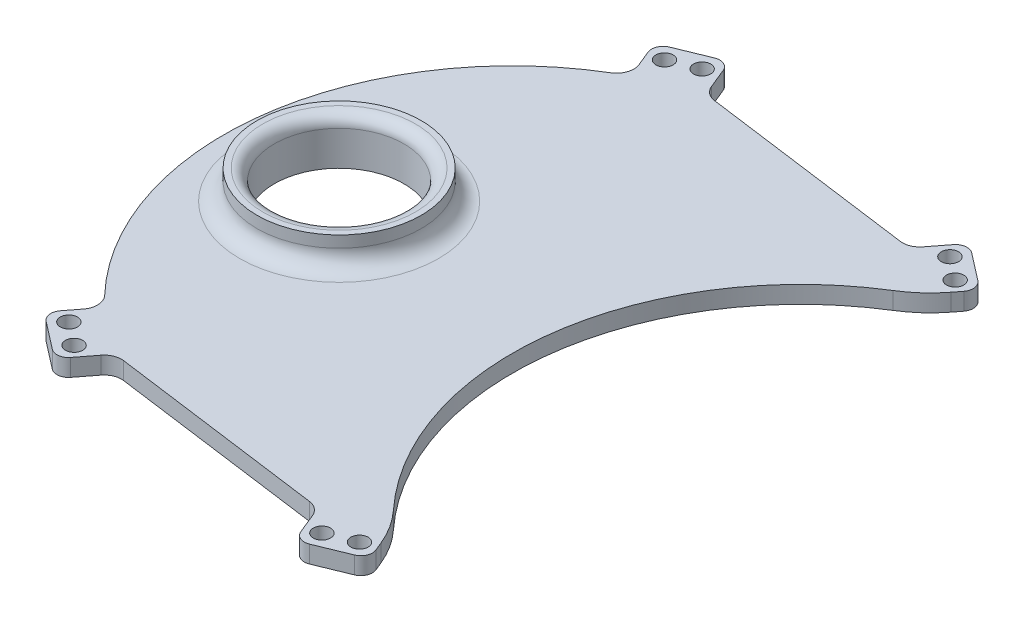
from build123d import *

# Parameters (mm, degrees)
BOSS_EXTRUDE1_DEPTH   = 3
BOSS_EXTRUDE1_2_DEPTH = 3
BOSS_EXTRUDE1_3_DEPTH = 3
BOSS_EXTRUDE1_4_DEPTH = 3
BOSS_EXTRUDE2_START   = -3
SKETCH2_R             = 11.25
BOSS_EXTRUDE2_DEPTH   = 3
CUT_EXTRUDE1_REACH    = 76.288
SKETCH3_R             = 1.5
FILLET1_R             = 2
SKETCH4_R             = 14.25
SKETCH4_R_2           = 11.25
BOSS_EXTRUDE3_DEPTH   = 5
FILLET3_R             = 2
FILLET2_R             = 3
CUT_EXTRUDE2_REACH    = 76.396
SKETCH6_R             = 1.5
FILLET4_R             = 2
CUT_EXTRUDE3_REACH    = 76.396
SKETCH7_R             = 1.5
FILLET5_R             = 2
CUT_EXTRUDE4_REACH    = 75.948
SKETCH8_R             = 1.5
FILLET6_R             = 2
FILLET7_R             = 3
FILLET8_R             = 20


with BuildPart() as part:
    # Sketch1 → Boss-Extrude1 (new body)
    with BuildSketch(Plane(origin=(0, 0, 0), x_dir=(1, 0, 0), z_dir=(0, 1, 0))):
        with BuildLine():
            Line((-34.371558273, -36.312476945), (-38.95676142, -42.247619075))
            Line((-38.95676142, -42.247619075), (-31.04323858, -48.361223271))
            Line((-31.04323858, -48.361223271), (-26.458035433, -42.426081141))
            ThreePointArc((-26.458035433, -42.426081141), (-30.568020981, -39.567614198), (-34.371558273, -36.312476945))
        make_face()
    extrude(amount=BOSS_EXTRUDE1_DEPTH)



with BuildPart() as body_2:
    # Sketch1 → Boss-Extrude1 2 (new body)
    with BuildSketch(Plane(origin=(0, 0, 0), x_dir=(1, 0, 0), z_dir=(0, 1, 0))):
        with BuildLine():
            Line((14.261748373, -47.922881104), (17.109130658, -54.861354576))
            Line((17.109130658, -54.861354576), (26.360428621, -51.064844862))
            Line((26.360428621, -51.064844862), (23.513046335, -44.12637139))
            ThreePointArc((23.513046335, -44.12637139), (18.982548572, -46.256489812), (14.261748373, -47.922881104))
        make_face()
    extrude(amount=BOSS_EXTRUDE1_2_DEPTH)


with BuildPart() as body_3:
    # Sketch1 → Boss-Extrude1 3 (new body)
    with BuildSketch(Plane(origin=(0, 0, 0), x_dir=(1, 0, 0), z_dir=(0, 1, 0))):
        with BuildLine():
            Line((34.371558273, 36.312476945), (38.95676142, 42.247619075))
            Line((38.95676142, 42.247619075), (31.04323858, 48.361223271))
            Line((31.04323858, 48.361223271), (26.458035433, 42.426081141))
            ThreePointArc((26.458035433, 42.426081141), (30.568020981, 39.567614198), (34.371558273, 36.312476945))
        make_face()
    extrude(amount=BOSS_EXTRUDE1_3_DEPTH)


with BuildPart() as body_4:
    # Sketch1 → Boss-Extrude1 4 (new body)
    with BuildSketch(Plane(origin=(0, 0, 0), x_dir=(1, 0, 0), z_dir=(0, 1, 0))):
        with BuildLine():
            Line((-14.261748373, 47.922881104), (-17.109130658, 54.861354576))
            Line((-17.109130658, 54.861354576), (-26.360428621, 51.064844862))
            Line((-26.360428621, 51.064844862), (-23.513046335, 44.12637139))
            ThreePointArc((-23.513046335, 44.12637139), (-18.982548572, 46.256489812), (-14.261748373, 47.922881104))
        make_face()
    extrude(amount=BOSS_EXTRUDE1_4_DEPTH)


with BuildPart() as part_1:
    add(part.part)

    add(body_2.part)  # Boss-Extrude2 merges body 2

    add(body_3.part)  # Boss-Extrude2 merges body 3

    add(body_4.part)  # Boss-Extrude2 merges body 4
    # Sketch2 → Boss-Extrude2 (add)
    with BuildSketch(Plane(origin=(0, 3, 0), x_dir=(1, 0, 0), z_dir=(0, 1, 0)).offset(BOSS_EXTRUDE2_START)):
        with BuildLine():
            Line((-26.458035433, -42.426081141), (14.261748373, -47.922881104))
            ThreePointArc((14.261748373, -47.922881104), (18.982548572, -46.256489812), (23.513046335, -44.12637139))
            ThreePointArc((23.513046335, -44.12637139), (8.334035055, -1.125018831), (34.371558273, 36.312476945))
            ThreePointArc((34.371558273, 36.312476945), (30.568020981, 39.567614198), (26.458035433, 42.426081141))
            Line((26.458035433, 42.426081141), (-14.261748373, 47.922881104))
            ThreePointArc((-14.261748373, 47.922881104), (-18.982548572, 46.256489812), (-23.513046335, 44.12637139))
            ThreePointArc((-23.513046335, 44.12637139), (-49.550569553, 6.688875614), (-34.371558273, -36.312476945))
            ThreePointArc((-34.371558273, -36.312476945), (-30.568020981, -39.567614198), (-26.458035433, -42.426081141))
        make_face()
        with Locations(Location((-30, 0, 0), (0, 0, 270))):
            Circle(SKETCH2_R, mode=Mode.SUBTRACT)
    extrude(amount=BOSS_EXTRUDE2_DEPTH)

    # Sketch3 → Cut-Extrude1 (cut, up to next)
    with BuildSketch(Plane(origin=(0, 3, 0), x_dir=(1, 0, 0), z_dir=(0, 1, 0)), mode=Mode.PRIVATE) as cut_extrude1_sk1:
        with Locations(Location((-35.297139556, -41.599801343, 0), (0, 0, 270))):
            Circle(SKETCH3_R)
    cut_extrude1_tool1 = extrude(cut_extrude1_sk1.sketch, amount=-CUT_EXTRUDE1_REACH, mode=Mode.PRIVATE) & part_1.part
    # Sketch3 → Cut-Extrude1 (cut, up to next)
    with BuildSketch(Plane(origin=(0, 3, 0), x_dir=(1, 0, 0), z_dir=(0, 1, 0)), mode=Mode.PRIVATE) as cut_extrude1_sk2:
        with Locations(Location((-31.340378136, -44.656603441, 0), (0, 0, 270))):
            Circle(SKETCH3_R)
    cut_extrude1_tool2 = extrude(cut_extrude1_sk2.sketch, amount=-CUT_EXTRUDE1_REACH, mode=Mode.PRIVATE) & part_1.part
    add(cut_extrude1_tool1.solids().sort_by_distance((-35.29714, 3, 41.599801))[0], mode=Mode.SUBTRACT)
    add(cut_extrude1_tool2.solids().sort_by_distance((-31.340378, 3, 44.656603))[0], mode=Mode.SUBTRACT)

    # Fillet1
    fillet1_edges = [part_1.edges().sort_by_distance(p)[0] for p in [
        (-31.04323858, 1.5, 48.361223271),
        (-38.95676142, 1.5, 42.247619075),
    ]]
    fillet(fillet1_edges, radius=FILLET1_R)

    # Sketch4 → Boss-Extrude3 (add)
    with BuildSketch(Plane(origin=(0, 3, 0), x_dir=(1, 0, 0), z_dir=(0, 1, 0))):
        with Locations(Location((-30, 0, 0), (0, 0, 270))):
            Circle(SKETCH4_R)
        with Locations(Location((-30, 0, 0), (0, 0, 270))):
            Circle(SKETCH4_R_2, mode=Mode.SUBTRACT)
    extrude(amount=BOSS_EXTRUDE3_DEPTH)

    # Fillet3
    fillet3_edges = [part_1.edges().sort_by_distance(p)[0] for p in [
        (-30, 8, -11.25),
    ]]
    fillet(fillet3_edges, radius=FILLET3_R)

    # Fillet2
    fillet2_edges = [part_1.edges().sort_by_distance(p)[0] for p in [
        (-30, 3, -14.25),
    ]]
    fillet(fillet2_edges, radius=FILLET2_R)

    # Sketch6 → Cut-Extrude2 (cut, up to next)
    with BuildSketch(Plane(origin=(0, 3, 0), x_dir=(1, 0, 0), z_dir=(0, 1, 0)), mode=Mode.PRIVATE) as cut_extrude2_sk1:
        with Locations(Location((18.377914978, -51.368120208, 0), (0, 0, 270))):
            Circle(SKETCH6_R)
    cut_extrude2_tool1 = extrude(cut_extrude2_sk1.sketch, amount=-CUT_EXTRUDE2_REACH, mode=Mode.PRIVATE) & part_1.part
    # Sketch6 → Cut-Extrude2 (cut, up to next)
    with BuildSketch(Plane(origin=(0, 3, 0), x_dir=(1, 0, 0), z_dir=(0, 1, 0)), mode=Mode.PRIVATE) as cut_extrude2_sk2:
        with Locations(Location((23.003563959, -49.469865351, 0), (0, 0, 270))):
            Circle(SKETCH6_R)
    cut_extrude2_tool2 = extrude(cut_extrude2_sk2.sketch, amount=-CUT_EXTRUDE2_REACH, mode=Mode.PRIVATE) & part_1.part
    add(cut_extrude2_tool1.solids().sort_by_distance((18.377915, 3, 51.36812))[0], mode=Mode.SUBTRACT)
    add(cut_extrude2_tool2.solids().sort_by_distance((23.003564, 3, 49.469865))[0], mode=Mode.SUBTRACT)

    # Fillet4
    fillet4_edges = [part_1.edges().sort_by_distance(p)[0] for p in [
        (17.109130658, 1.5, 54.861354576),
        (26.360428621, 1.5, 51.064844862),
    ]]
    fillet(fillet4_edges, radius=FILLET4_R)

    # Sketch7 → Cut-Extrude3 (cut, up to next)
    with BuildSketch(Plane(origin=(0, 3, 0), x_dir=(1, 0, 0), z_dir=(0, 1, 0)), mode=Mode.PRIVATE) as cut_extrude3_sk1:
        with Locations(Location((-18.377914978, 51.368120208, 0), (0, 0, 270))):
            Circle(SKETCH7_R)
    cut_extrude3_tool1 = extrude(cut_extrude3_sk1.sketch, amount=-CUT_EXTRUDE3_REACH, mode=Mode.PRIVATE) & part_1.part
    # Sketch7 → Cut-Extrude3 (cut, up to next)
    with BuildSketch(Plane(origin=(0, 3, 0), x_dir=(1, 0, 0), z_dir=(0, 1, 0)), mode=Mode.PRIVATE) as cut_extrude3_sk2:
        with Locations(Location((-23.003563959, 49.469865351, 0), (0, 0, 270))):
            Circle(SKETCH7_R)
    cut_extrude3_tool2 = extrude(cut_extrude3_sk2.sketch, amount=-CUT_EXTRUDE3_REACH, mode=Mode.PRIVATE) & part_1.part
    add(cut_extrude3_tool1.solids().sort_by_distance((-18.377915, 3, -51.36812))[0], mode=Mode.SUBTRACT)
    add(cut_extrude3_tool2.solids().sort_by_distance((-23.003564, 3, -49.469865))[0], mode=Mode.SUBTRACT)

    # Fillet5
    fillet5_edges = [part_1.edges().sort_by_distance(p)[0] for p in [
        (-17.109130658, 1.5, -54.861354576),
        (-26.360428621, 1.5, -51.064844862),
    ]]
    fillet(fillet5_edges, radius=FILLET5_R)

    # Sketch8 → Cut-Extrude4 (cut, up to next)
    with BuildSketch(Plane(origin=(0, 3, 0), x_dir=(1, 0, 0), z_dir=(0, 1, 0)), mode=Mode.PRIVATE) as cut_extrude4_sk1:
        with Locations(Location((35.297139556, 41.599801343, 0), (0, 0, 270))):
            Circle(SKETCH8_R)
    cut_extrude4_tool1 = extrude(cut_extrude4_sk1.sketch, amount=-CUT_EXTRUDE4_REACH, mode=Mode.PRIVATE) & part_1.part
    # Sketch8 → Cut-Extrude4 (cut, up to next)
    with BuildSketch(Plane(origin=(0, 3, 0), x_dir=(1, 0, 0), z_dir=(0, 1, 0)), mode=Mode.PRIVATE) as cut_extrude4_sk2:
        with Locations(Location((31.340378136, 44.656603441, 0), (0, 0, 270))):
            Circle(SKETCH8_R)
    cut_extrude4_tool2 = extrude(cut_extrude4_sk2.sketch, amount=-CUT_EXTRUDE4_REACH, mode=Mode.PRIVATE) & part_1.part
    add(cut_extrude4_tool1.solids().sort_by_distance((35.29714, 3, -41.599801))[0], mode=Mode.SUBTRACT)
    add(cut_extrude4_tool2.solids().sort_by_distance((31.340378, 3, -44.656603))[0], mode=Mode.SUBTRACT)

    # Fillet6
    fillet6_edges = [part_1.edges().sort_by_distance(p)[0] for p in [
        (38.95676142, 1.5, -42.247619075),
        (31.04323858, 1.5, -48.361223271),
    ]]
    fillet(fillet6_edges, radius=FILLET6_R)

    # Fillet7
    fillet7_edges = [part_1.edges().sort_by_distance(p)[0] for p in [
        (14.261748373, 1.5, 47.922881104),
        (26.458035433, 1.5, -42.426081141),
        (-14.261748373, 1.5, -47.922881104),
        (-23.513046335, 1.5, -44.12637139),
        (-26.458035433, 1.5, 42.426081141),
        (-34.371558273, 1.5, 36.312476945),
    ]]
    fillet(fillet7_edges, radius=FILLET7_R)

    # Fillet8
    fillet8_edges = [part_1.edges().sort_by_distance(p)[0] for p in [
        (23.513046335, 1.5, 44.12637139),
        (34.371558273, 1.5, -36.312476945),
    ]]
    fillet(fillet8_edges, radius=FILLET8_R)


solid = part_1.part
